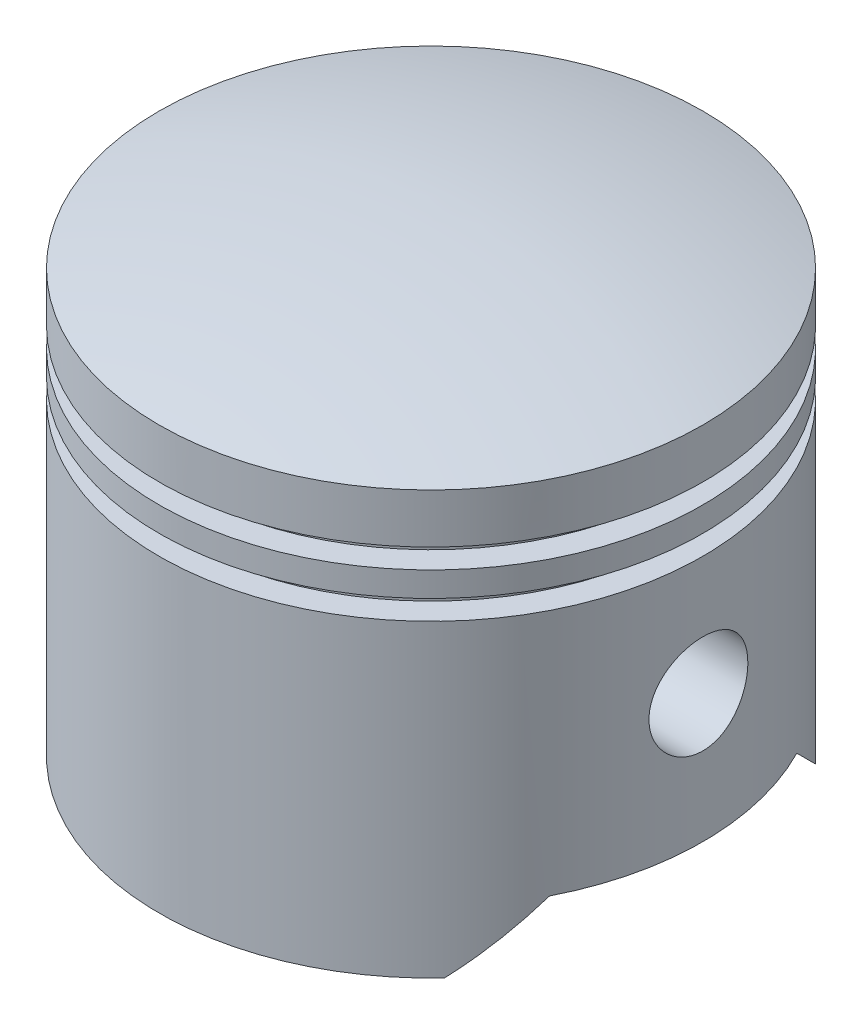
from build123d import *

# Parameters (mm, degrees)
CUT_EXTRUDE_2_DEPTH      = 39.105117767
CUT_EXTRUDE_2_DEPTH_BACK = 39.105117767
SKETCH_4_R               = 4
SKETCH_6_R               = 20
CUT_EXTRUDE_3_DEPTH      = 5
CUT_EXTRUDE_4_DEPTH      = 6
EXTRUDE_1_REACH          = 46.896
EXTRUDE_1_END_RADIUS     = 75


with BuildPart() as part:
    # 草图1 → 旋转3 (revolve)
    with BuildSketch(Plane.XY):
        with BuildLine():
            Line((-22, 9.633147735), (-22, -15.366852265))
            Line((-22, -15.366852265), (0, -15.366852265))
            Line((0, -15.366852265), (0, 22))
            ThreePointArc((0, 22), (-11.113381048, 21.204227615), (-22, 18.833147735))
            Line((-22, 18.833147735), (-22, 14.833147735))
            Line((-22, 14.833147735), (-20, 14.833147735))
            Line((-20, 14.833147735), (-20, 13.233147735))
            Line((-20, 13.233147735), (-22, 13.233147735))
            Line((-22, 13.233147735), (-22, 11.233147735))
            Line((-22, 11.233147735), (-20, 11.233147735))
            Line((-20, 11.233147735), (-20, 9.633147735))
            Line((-20, 9.633147735), (-22, 9.633147735))
        make_face()
    revolve(axis=Axis((0, 22, 0), (0, -1, 0)))

    # 草图4 → 切除-拉伸2 (cut, two sides: drawn at the far end of the back side and taken through both)
    with BuildSketch(Plane(origin=(0, 0, 0), x_dir=(0, 0, -1), z_dir=(1, 0, 0)).offset(-CUT_EXTRUDE_2_DEPTH_BACK)):
        Circle(SKETCH_4_R)
        Polygon((-15, -15.366852265), (-10, -10.366852265), (10, -10.366852265), (15, -15.366852265), align=None)
    extrude(amount=CUT_EXTRUDE_2_DEPTH + CUT_EXTRUDE_2_DEPTH_BACK, mode=Mode.SUBTRACT)

    # 草图6 → 切除-拉伸3 (cut)
    with BuildSketch(Plane.XZ.offset(15.366852265)):
        with Locations(Location((0, 0, 0), (0, 0, 180))):
            Circle(SKETCH_6_R)
    extrude(amount=-CUT_EXTRUDE_3_DEPTH, mode=Mode.SUBTRACT)

    # 草图8 → 切除-拉伸4 (cut, symmetric)
    with BuildSketch(Plane(origin=(0, 0, 0), x_dir=(0, 0, -1), z_dir=(1, 0, 0))):
        with BuildLine():
            Line((-16, 17.273460407), (-16, -10.366852265))
            Line((-16, -10.366852265), (16, -10.366852265))
            Line((16, -10.366852265), (16, 17.273460407))
            ThreePointArc((16, 17.273460407), (0, 19), (-16, 17.273460407))
        make_face()
    extrude(amount=CUT_EXTRUDE_4_DEPTH, both=True, mode=Mode.SUBTRACT)

    # 凸台-拉伸1: up to this cylinder (the profile starts inside it)
    extrude_1_end = Plane(origin=(0, -56, 0), z_dir=(1, 0, 0)) * Cylinder(EXTRUDE_1_END_RADIUS, 253.81433, mode=Mode.PRIVATE)
    # 草图9 → 凸台-拉伸1 (add, up to the surface)
    with BuildSketch(Plane.XZ.offset(10.366852265), mode=Mode.PRIVATE) as extrude_1_sk1:
        with BuildLine():
            Line((6, -16), (6, -14.832396974))
            ThreePointArc((6, -14.832396974), (3.056276215, -15.705386837), (3.1e-08, -16))
            Line((3.1e-08, -16), (6, -16))
        make_face()
    extrude_1_tool1 = extrude(extrude_1_sk1.sketch, amount=-EXTRUDE_1_REACH, mode=Mode.PRIVATE) & extrude_1_end
    add(extrude_1_tool1.solids().sort_by_distance((4.511165, -10.366852, -15.652025))[0])
    # 草图9 → 凸台-拉伸1 (add, up to the surface)
    with BuildSketch(Plane.XZ.offset(10.366852265), mode=Mode.PRIVATE) as extrude_1_sk2:
        with BuildLine():
            Line((-6, -16), (3.1e-08, -16))
            ThreePointArc((3.1e-08, -16), (-3.056276184, -15.705386843), (-6, -14.832396974))
            Line((-6, -14.832396974), (-6, -16))
        make_face()
    extrude_1_tool2 = extrude(extrude_1_sk2.sketch, amount=-EXTRUDE_1_REACH, mode=Mode.PRIVATE) & extrude_1_end
    add(extrude_1_tool2.solids().sort_by_distance((-4.511165, -10.366852, -15.652025))[0])
    # 草图9 → 凸台-拉伸1 (add, up to the surface)
    with BuildSketch(Plane.XZ.offset(10.366852265), mode=Mode.PRIVATE) as extrude_1_sk3:
        with BuildLine():
            ThreePointArc((-6, 14.832396974), (-3.056276199, 15.70538684), (0, 16))
            Line((0, 16), (-6, 16))
            Line((-6, 16), (-6, 14.832396974))
        make_face()
    extrude_1_tool3 = extrude(extrude_1_sk3.sketch, amount=-EXTRUDE_1_REACH, mode=Mode.PRIVATE) & extrude_1_end
    add(extrude_1_tool3.solids().sort_by_distance((-4.511165, -10.366852, 15.652025))[0])
    # 草图9 → 凸台-拉伸1 (add, up to the surface)
    with BuildSketch(Plane.XZ.offset(10.366852265), mode=Mode.PRIVATE) as extrude_1_sk4:
        with BuildLine():
            Line((6, 14.832396974), (6, 16))
            Line((6, 16), (0, 16))
            ThreePointArc((0, 16), (3.056276199, 15.70538684), (6, 14.832396974))
        make_face()
    extrude_1_tool4 = extrude(extrude_1_sk4.sketch, amount=-EXTRUDE_1_REACH, mode=Mode.PRIVATE) & extrude_1_end
    add(extrude_1_tool4.solids().sort_by_distance((4.511165, -10.366852, 15.652025))[0])


solid = part.part
